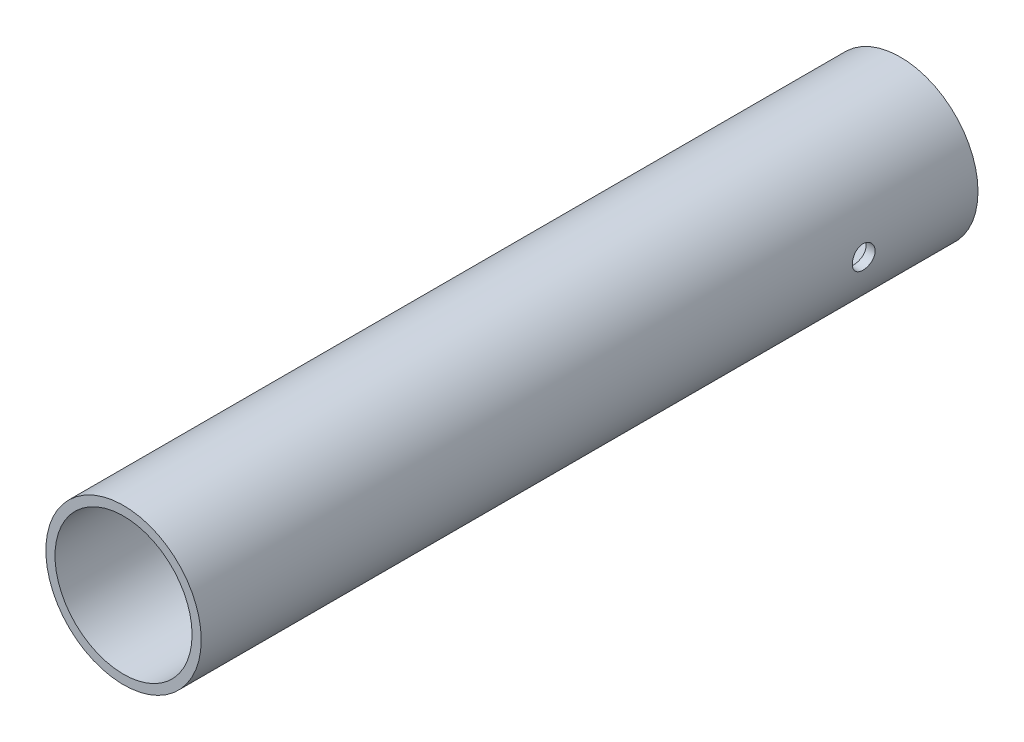
from build123d import *

# Parameters (mm, degrees)
SKETCH1_R               = 17
SKETCH1_R_2             = 15
BOSS_EXTRUDE1_DEPTH     = 85
CUT_EXTRUDE1_DEPTH      = 89.334591186
CUT_EXTRUDE1_DEPTH_BACK = 89.334591186
SKETCH2_R               = 2.5


with BuildPart() as part:
    # Sketch1 → Boss-Extrude1 (new, symmetric)
    with BuildSketch(Plane.XY):
        Circle(SKETCH1_R)
        Circle(SKETCH1_R_2, mode=Mode.SUBTRACT)
    extrude(amount=BOSS_EXTRUDE1_DEPTH, both=True)

    # Sketch2 → Cut-Extrude1 (cut, two sides: drawn at the far end of the back side and taken through both)
    with BuildSketch(Plane(origin=(0, 0, 0), x_dir=(0, 0, -1), z_dir=(1, 0, 0)).offset(-CUT_EXTRUDE1_DEPTH_BACK)):
        with Locations((60, 0)):
            Circle(SKETCH2_R)
    extrude(amount=CUT_EXTRUDE1_DEPTH + CUT_EXTRUDE1_DEPTH_BACK, mode=Mode.SUBTRACT)


solid = part.part
